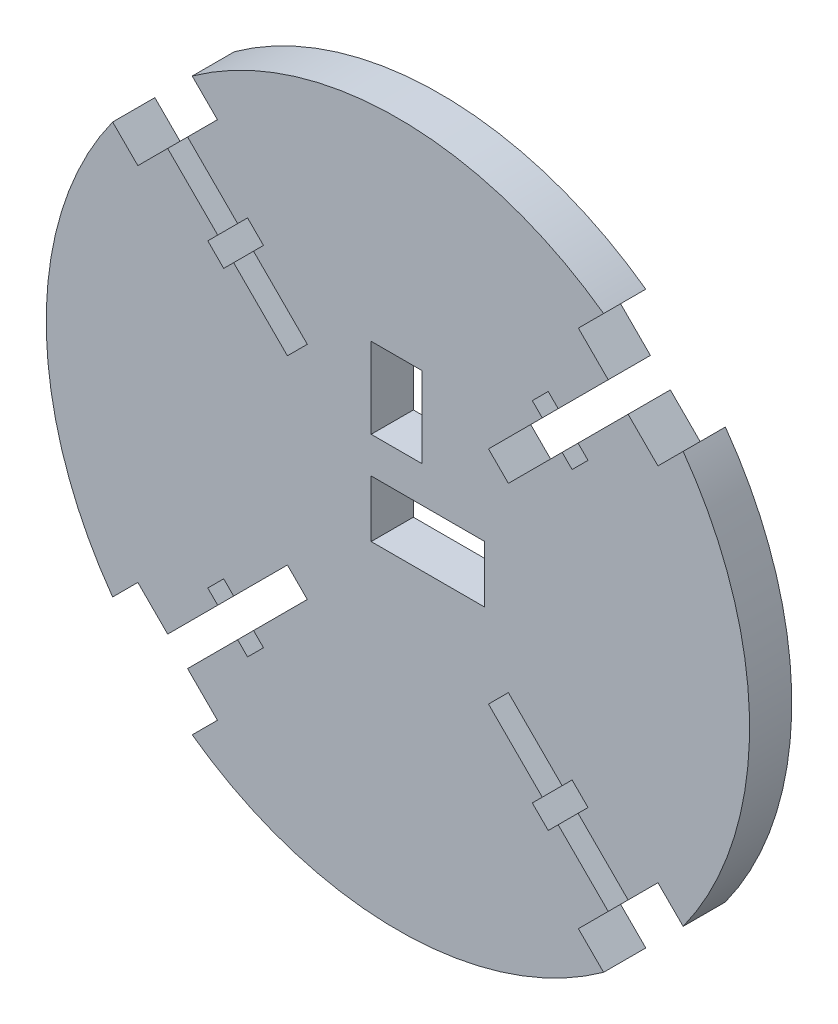
from build123d import *

# Parameters (mm, degrees)
ESQUISSE1_R                  = 125
ESQUISSE1_W                  = 40.2
ESQUISSE1_H                  = 20.2
ESQUISSE1_W_2                = 18.123947537
ESQUISSE1_H_2                = 28.637153683
BOSS_EXTRU_1_DEPTH           = 15
ENL_V_MAT_EXTRU_1_DEPTH      = 15
R_P_TITION_CIRCULAIRE1_COUNT = 4


with BuildPart() as part:
    # Esquisse1 → Boss.-Extru.1 (new body)
    with BuildSketch(Plane.XY):
        Circle(ESQUISSE1_R)
        with Locations((10.6, 0)):
            Rectangle(ESQUISSE1_W, ESQUISSE1_H, mode=Mode.SUBTRACT)
        with Locations((-0.438026231, 37.232201346)):
            Rectangle(ESQUISSE1_W_2, ESQUISSE1_H_2, mode=Mode.SUBTRACT)
    extrude(amount=BOSS_EXTRU_1_DEPTH)

    # Esquisse3 → Enlèv. mat.-Extru.1 (cut)
    with BuildSketch(Plane.XY.offset(15)):
        Polygon((112.62821071, -84.343939462), (92.432755834, -64.148484587), (64.148484587, -92.432755834), (84.343939462, -112.62821071), align=None)
        Polygon((81.950288575, -89.021356387), (89.021356387, -81.950288575), (39.271363502, -32.20029569), (32.20029569, -39.271363502), align=None)
        Polygon((53.431679247, -67.573814871), (67.573814871, -53.431679247), (61.916960621, -47.774824997), (47.774824997, -61.916960621), align=None)
    enl_v_mat_extru_1 = extrude(amount=-ENL_V_MAT_EXTRU_1_DEPTH, mode=Mode.SUBTRACT)

    # Répétition circulaire1: Enlèv. mat.-Extru.1 ×4 about axis
    r_p_tition_circulaire1_axis = Axis((0, 0, 0), (0, 0, 1))
    for i in range(1, R_P_TITION_CIRCULAIRE1_COUNT):
        add(enl_v_mat_extru_1.rotate(r_p_tition_circulaire1_axis, i * 360 / R_P_TITION_CIRCULAIRE1_COUNT), mode=Mode.SUBTRACT)


solid = part.part
